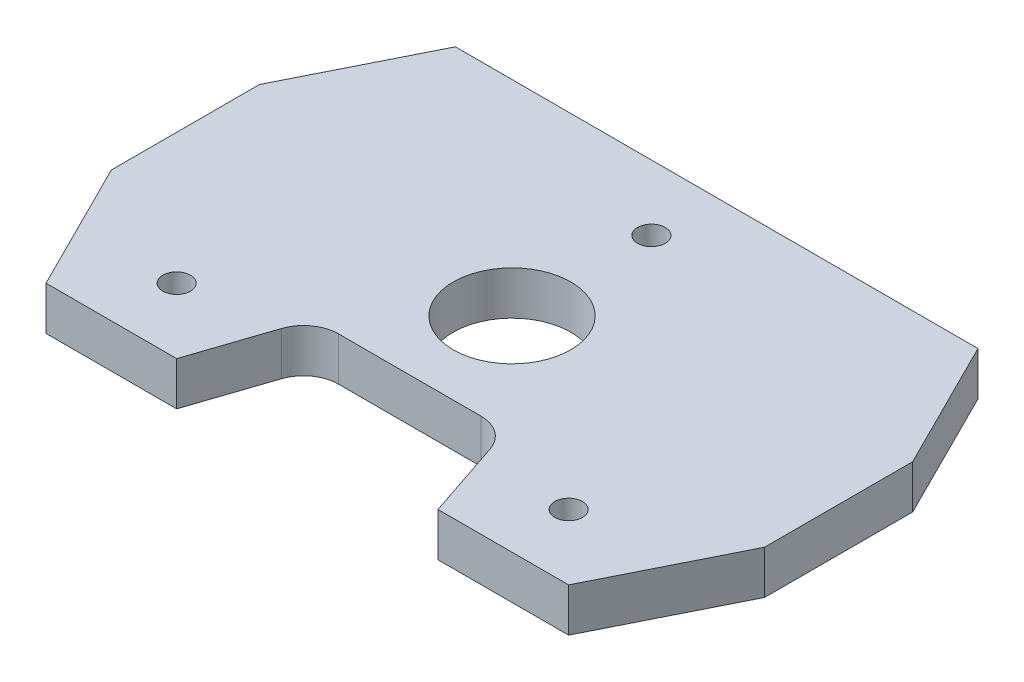
from build123d import *

# Parameters (mm, degrees)
SKETCH1_R           = 3.175
SKETCH1_R_2         = 13.5
BOSS_EXTRUDE1_DEPTH = 10


with BuildPart() as part:
    # Sketch1 → Boss-Extrude1 (new body)
    with BuildSketch(Plane(origin=(0, 0, 0), x_dir=(1, 0, 0), z_dir=(0, 1, 0))):
        with BuildLine():
            Line((-60, 27.300970874), (60, 27.300970874))
            Line((60, 27.300970874), (75, -2.699029126))
            Line((75, -2.699029126), (75, -36.699029126))
            Line((75, -36.699029126), (60, -66.699029126))
            Line((60, -66.699029126), (30, -66.699029126))
            Line((30, -66.699029126), (23.949215607, -48.655488788))
            ThreePointArc((23.949215607, -48.655488788), (21.036148951, -44.704865488), (16.364335743, -43.199029126))
            Line((16.364335743, -43.199029126), (-16.364335743, -43.199029126))
            ThreePointArc((-16.364335743, -43.199029126), (-21.036148951, -44.704865488), (-23.949215607, -48.655488788))
            Line((-23.949215607, -48.655488788), (-30, -66.699029126))
            Line((-30, -66.699029126), (-60, -66.699029126))
            Line((-60, -66.699029126), (-75, -36.699029126))
            Line((-75, -36.699029126), (-75, -2.699029126))
            Line((-75, -2.699029126), (-60, 27.300970874))
        make_face()
        with Locations(Location((-45, -51.699029126, 0), (0, 0, 270))):
            Circle(SKETCH1_R, mode=Mode.SUBTRACT)
        with Locations(Location((0, 12.300970874, 0), (0, 0, 270))):
            Circle(SKETCH1_R, mode=Mode.SUBTRACT)
        with Locations(Location((45, -51.699029126, 0), (0, 0, 270))):
            Circle(SKETCH1_R, mode=Mode.SUBTRACT)
        with Locations(Location((0, -19.699029126, 0), (0, 0, 270))):
            Circle(SKETCH1_R_2, mode=Mode.SUBTRACT)
    extrude(amount=BOSS_EXTRUDE1_DEPTH)


solid = part.part
